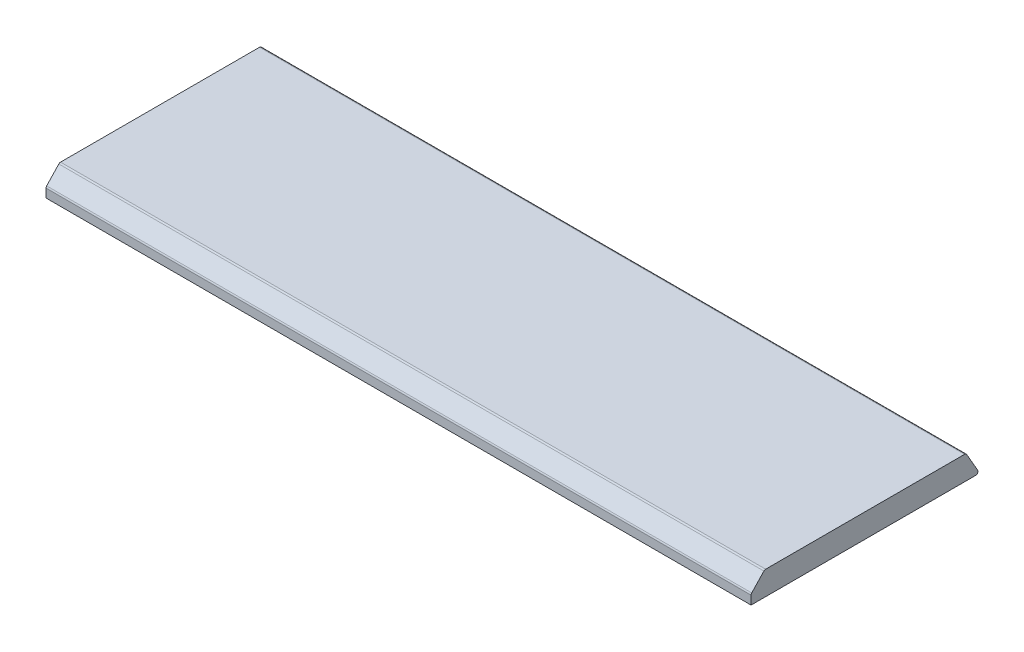
from build123d import *

# Parameters (mm, degrees)
BOSS_EXTRUDE1_DEPTH = 234.95
FILLET1_R           = 0.79375


with BuildPart() as part:
    # Sketch1 → Boss-Extrude1 (new body)
    with BuildSketch(Plane(origin=(0, 0, 0), x_dir=(0, 0, -1), z_dir=(1, 0, 0))):
        Polygon((0, 0), (76.2, 0), (71.617282238, 7.9375), (4.506031045, 7.9375), (0, 3.175), align=None)
    extrude(amount=-BOSS_EXTRUDE1_DEPTH)

    # Fillet1
    fillet1_edges = [part.edges().sort_by_distance(p)[0] for p in [
        (-117.475, 3.175, 0),
        (-117.475, 7.9375, -4.506031045),
        (-117.475, 7.9375, -71.617282238),
        (-117.475, 0, -76.2),
    ]]
    fillet(fillet1_edges, radius=FILLET1_R)


solid = part.part
